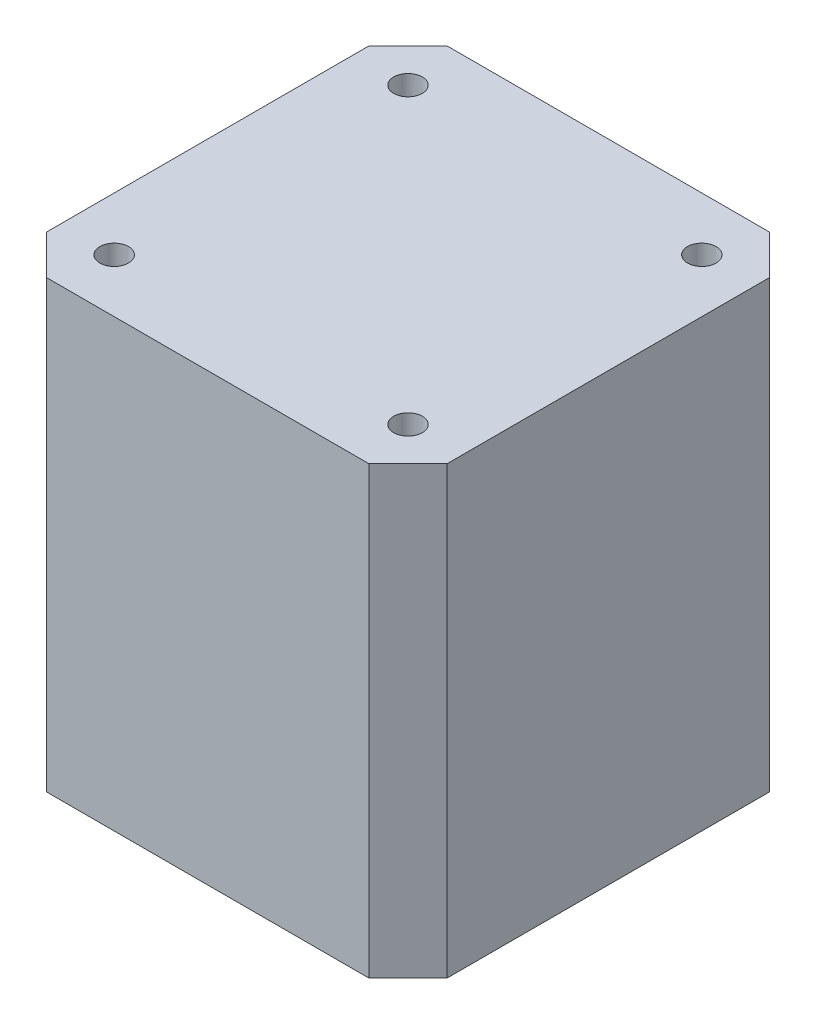
from build123d import *

# Parameters (mm, degrees)
SKETCH1_R           = 1.51
BOSS_EXTRUDE1_DEPTH = 47
SKETCH4_R           = 2.475
BOSS_EXTRUDE2_DEPTH = 10
FILLET1_R           = 0.3


with BuildPart() as part:
    # Sketch1 → Boss-Extrude1 (new body)
    with BuildSketch(Plane(origin=(0, 0, 0), x_dir=(1, 0, 0), z_dir=(0, 1, 0))):
        Polygon((-17.01, 21.15), (-21.15, 17.01), (-21.15, -17.01), (-17.01, -21.15), (17.01, -21.15), (21.15, -17.01), (21.15, 17.01), (17.01, 21.15), align=None)
        with Locations(Location((15.5, 15.5, 0), (0, 0, 270))):
            Circle(SKETCH1_R, mode=Mode.SUBTRACT)
        with Locations(Location((15.5, -15.5, 0), (0, 0, 270))):
            Circle(SKETCH1_R, mode=Mode.SUBTRACT)
        with Locations(Location((-15.5, -15.5, 0), (0, 0, 270))):
            Circle(SKETCH1_R, mode=Mode.SUBTRACT)
        with Locations(Location((-15.5, 15.5, 0), (0, 0, 270))):
            Circle(SKETCH1_R, mode=Mode.SUBTRACT)
    extrude(amount=BOSS_EXTRUDE1_DEPTH)

    # Sketch4 → Boss-Extrude2 (add)
    with BuildSketch(Plane(origin=(0, 0, 0), x_dir=(1, 0, 0), z_dir=(0, 1, 0))):
        with Locations(Location((0, 0, 0), (0, 0, 270))):
            Circle(SKETCH4_R)
    extrude(amount=-BOSS_EXTRUDE2_DEPTH)

    # Fillet1
    fillet1_edges = [part.edges().sort_by_distance(p)[0] for p in [
        (0, -10, -2.475),
    ]]
    fillet(fillet1_edges, radius=FILLET1_R)


solid = part.part
